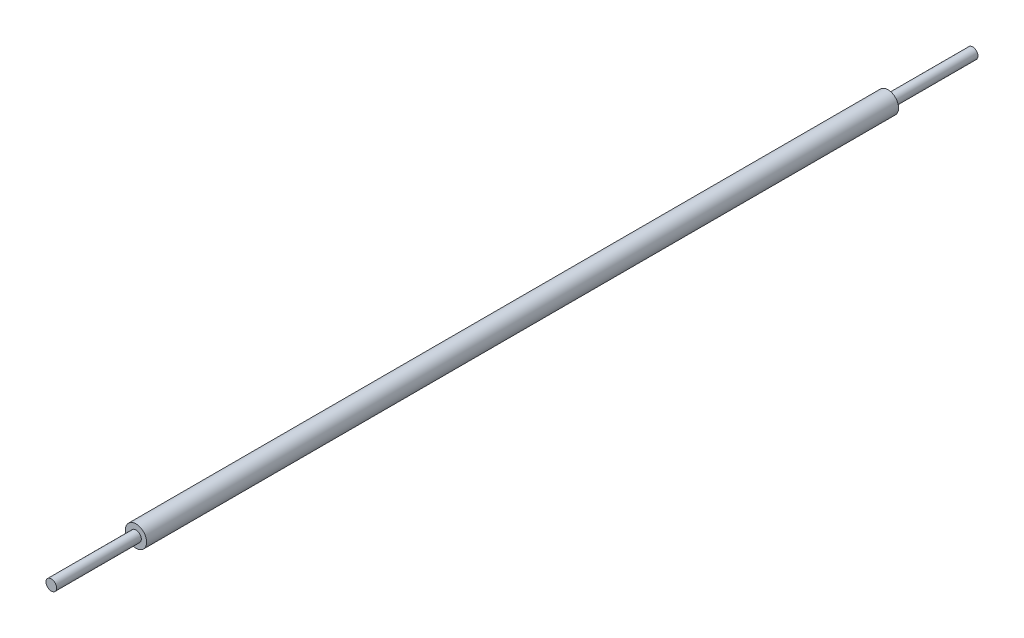
from build123d import *

# Parameters (mm, degrees)
SKETCH1_R           = 2.5
BOSS_EXTRUDE1_DEPTH = 177.5
SKETCH2_R           = 1.25
BOSS_EXTRUDE2_DEPTH = 20
BOSS_EXTRUDE3_START = 20
SKETCH3_R           = 1.25
BOSS_EXTRUDE3_DEPTH = 20


with BuildPart() as part:
    # Sketch1 → Boss-Extrude1 (new body)
    with BuildSketch(Plane.XY):
        Circle(SKETCH1_R)
    extrude(amount=BOSS_EXTRUDE1_DEPTH)

    # Sketch2 → Boss-Extrude2 (add)
    with BuildSketch(Plane.XY.offset(177.5)):
        Circle(SKETCH2_R)
    extrude(amount=BOSS_EXTRUDE2_DEPTH)

    # Sketch3 → Boss-Extrude3 (add)
    with BuildSketch(Plane(origin=(0, 0, 0), x_dir=(-1, 0, 0), z_dir=(0, 0, -1)).offset(BOSS_EXTRUDE3_START)):
        with Locations(Location((0, 0, 0), (0, 0, 180))):
            Circle(SKETCH3_R)
    extrude(amount=-BOSS_EXTRUDE3_DEPTH)


solid = part.part
